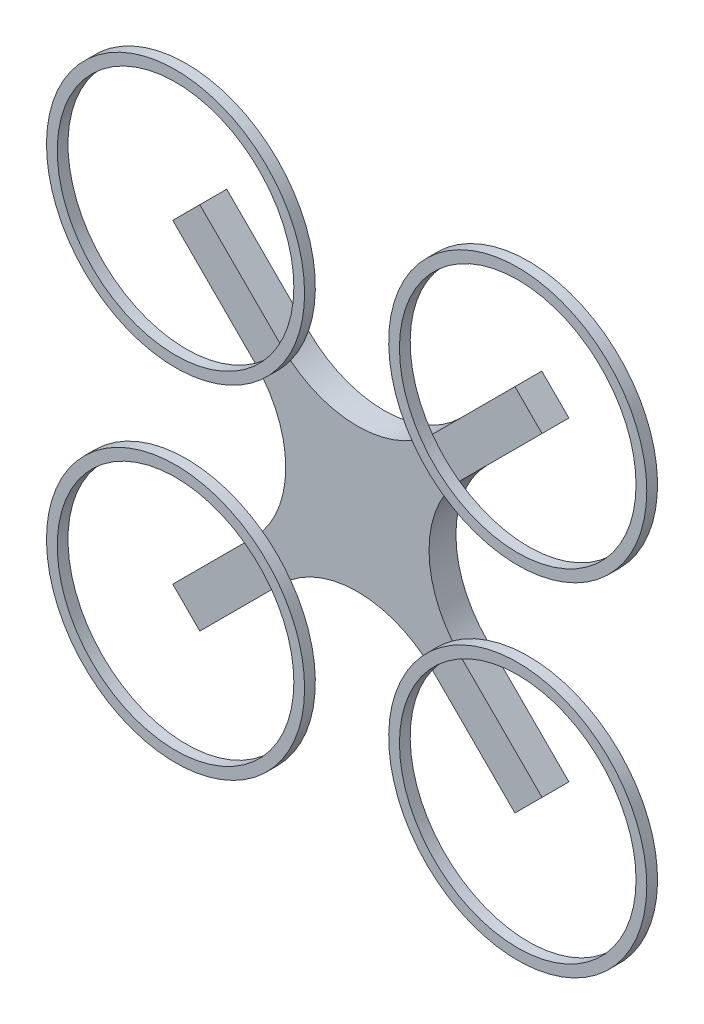
from build123d import *

# Parameters (mm, degrees)
BOSS_EXTRUDE1_DEPTH = 5
FILLET1_R           = 20
SKETCH3_R           = 24
SKETCH3_R_2         = 22
BOSS_EXTRUDE2_DEPTH = 2


with BuildPart() as part:
    # Sketch2 → Boss-Extrude1 (new body)
    with BuildSketch(Plane.XY):
        Polygon((0, 5.039474274), (29.300068016, 34.339542291), (34.339542291, 29.300068016), (5.039474274, 0), (34.339542291, -29.300068016), (29.300068016, -34.339542291), (0, -5.039474274), (-29.300068016, -34.339542291), (-34.339542291, -29.300068016), (-5.039474274, 0), (-34.339542291, 29.300068016), (-29.300068016, 34.339542291), align=None)
    extrude(amount=BOSS_EXTRUDE1_DEPTH)

    # Fillet1
    fillet1_edges = [part.edges().sort_by_distance(p)[0] for p in [
        (0, -5.039474274, 2.5),
        (-5.039474274, 0, 2.5),
        (0, 5.039474274, 2.5),
        (5.039474274, 0, 2.5),
    ]]
    fillet(fillet1_edges, radius=FILLET1_R)

    # Sketch3 → Boss-Extrude2 (add)
    # profile 1 of 4: a face of its own
    with BuildSketch(Plane.XY.offset(5)):
        with Locations(Location((-31.819805153, 31.819805153, 0), (0, 0, 306.147120123))):
            Circle(SKETCH3_R)
        with Locations(Location((-31.819805153, 31.819805153, 0), (0, 0, 305.673554169))):
            Circle(SKETCH3_R_2, mode=Mode.SUBTRACT)
    # profile 2 of 4: a face of its own
    with BuildSketch(Plane.XY.offset(5)):
        with Locations(Location((31.819805153, 31.819805153, 0), (0, 0, 216.147120123))):
            Circle(SKETCH3_R)
        with Locations(Location((31.819805153, 31.819805153, 0), (0, 0, 215.673554169))):
            Circle(SKETCH3_R_2, mode=Mode.SUBTRACT)
    # profile 3 of 4: a face of its own
    with BuildSketch(Plane.XY.offset(5)):
        with Locations(Location((31.819805153, -31.819805153, 0), (0, 0, 143.852879877))):
            Circle(SKETCH3_R)
        with Locations(Location((31.819805153, -31.819805153, 0), (0, 0, 144.326445831))):
            Circle(SKETCH3_R_2, mode=Mode.SUBTRACT)
    # profile 4 of 4: a face of its own
    with BuildSketch(Plane.XY.offset(5)):
        with Locations(Location((-31.819805153, -31.819805153, 0), (0, 0, 53.852879877))):
            Circle(SKETCH3_R)
        with Locations(Location((-31.819805153, -31.819805153, 0), (0, 0, 54.326445831))):
            Circle(SKETCH3_R_2, mode=Mode.SUBTRACT)
    extrude(amount=BOSS_EXTRUDE2_DEPTH)


solid = part.part
